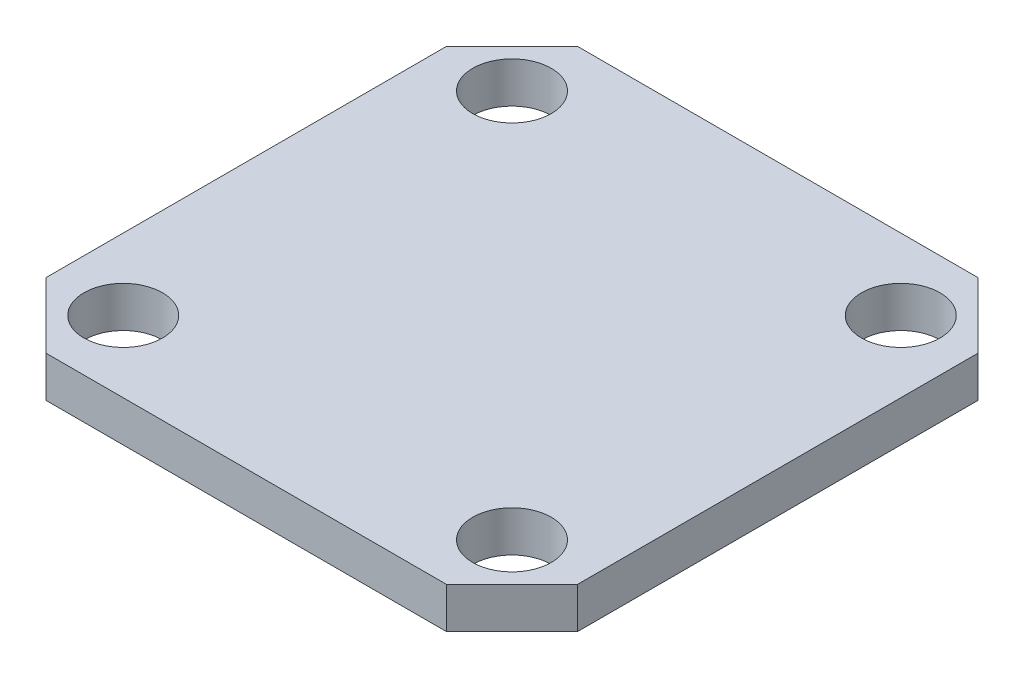
from build123d import *

# Parameters (mm, degrees)
SKETCH1_W           = 20.6248
SKETCH1_H           = 20.6248
BOSS_EXTRUDE1_DEPTH = 1.5875
CHAMFER1_SIZE       = 2.54
SKETCH2_R           = 1.524
CUT_EXTRUDE1_DEPTH  = 15.670083291


with BuildPart() as part:
    # Sketch1 → Boss-Extrude1 (new body)
    with BuildSketch(Plane(origin=(0, 0, 0), x_dir=(1, 0, 0), z_dir=(0, 1, 0))):
        Rectangle(SKETCH1_W, SKETCH1_H)
    extrude(amount=BOSS_EXTRUDE1_DEPTH)

    # Chamfer1
    chamfer1_edges = [part.edges().sort_by_distance(p)[0] for p in [
        (10.3124, 0.79375, 10.3124),
        (-10.3124, 0.79375, 10.3124),
        (-10.3124, 0.79375, -10.3124),
        (10.3124, 0.79375, -10.3124),
    ]]
    chamfer(chamfer1_edges, length=CHAMFER1_SIZE)

    # Sketch2 → Cut-Extrude1 (cut, through all)
    with BuildSketch(Plane(origin=(0, 1.5875, 0), x_dir=(1, 0, 0), z_dir=(0, 1, 0))):
        with Locations(Location((-7.5438, 7.5438, 0), (0, 0, 270))):
            Circle(SKETCH2_R)
        with Locations(Location((7.5438, 7.5438, 0), (0, 0, 270))):
            Circle(SKETCH2_R)
        with Locations(Location((7.5438, -7.5438, 0), (0, 0, 270))):
            Circle(SKETCH2_R)
        with Locations(Location((-7.5438, -7.5438, 0), (0, 0, 270))):
            Circle(SKETCH2_R)
    extrude(amount=-CUT_EXTRUDE1_DEPTH, mode=Mode.SUBTRACT)


solid = part.part
